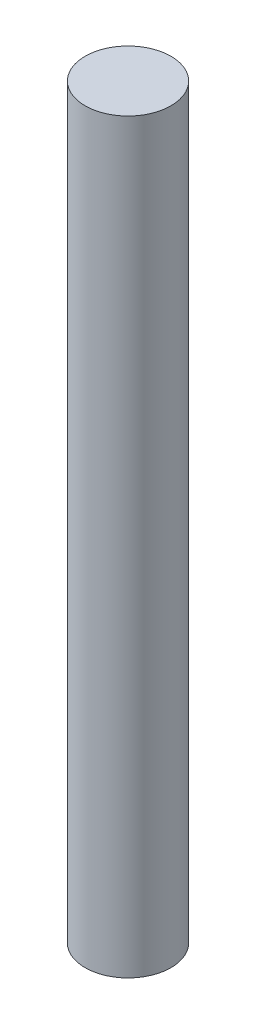
from build123d import *

# Parameters (mm, degrees)
SKETCH1_R           = 1.4605
BOSS_EXTRUDE1_DEPTH = 25.4


with BuildPart() as part:
    # Sketch1 → Boss-Extrude1 (new body)
    with BuildSketch(Plane(origin=(0, 0, 0), x_dir=(1, 0, 0), z_dir=(0, 1, 0))):
        with Locations(Location((0, 0, 0), (0, 0, 90))):
            Circle(SKETCH1_R)
    extrude(amount=BOSS_EXTRUDE1_DEPTH)


solid = part.part
